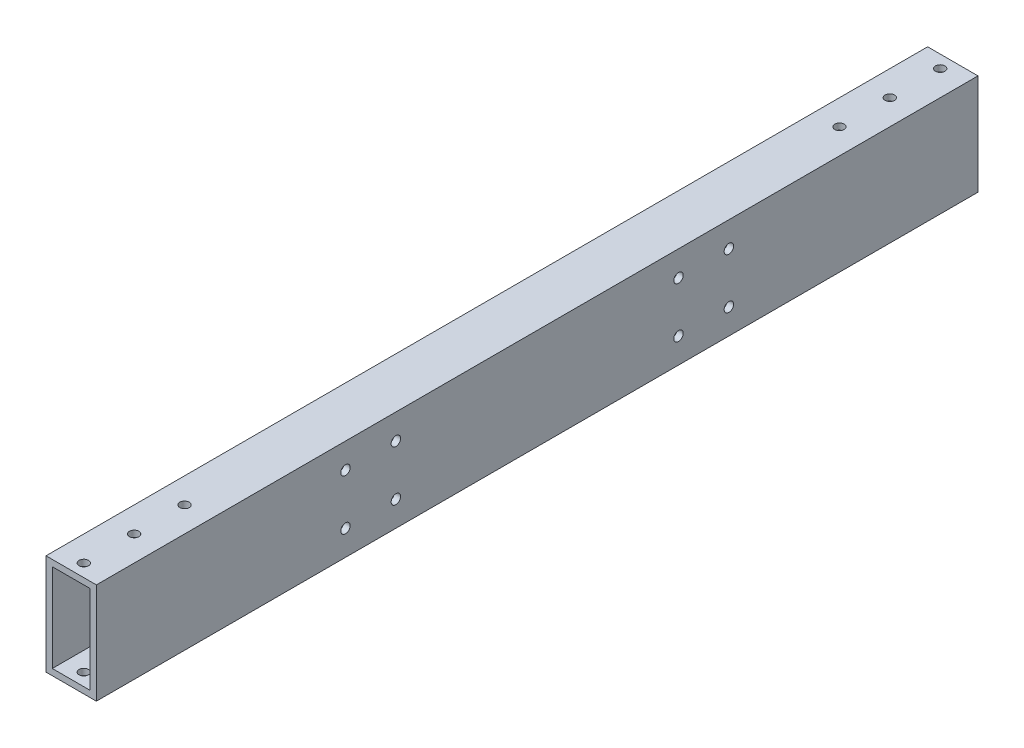
from build123d import *

# Parameters (mm, degrees)
SKETCH1_W           = 25.4
SKETCH1_H           = 50.8
BOSS_EXTRUDE1_DEPTH = 444.5
SHELL1_T            = -3.175
SKETCH2_R           = 2.38125
CUT_EXTRUDE1_DEPTH  = 448.573658742
SKETCH3_R           = 2.38125
CUT_EXTRUDE2_DEPTH  = 6.35


with BuildPart() as part:
    # Sketch1 → Boss-Extrude1 (new body)
    with BuildSketch(Plane.XY):
        Rectangle(SKETCH1_W, SKETCH1_H)
    extrude(amount=BOSS_EXTRUDE1_DEPTH)

    # Shell1
    shell1_openings = [part.faces().sort_by_distance(p)[0] for p in [
        (0, 0, 444.5),
        (0, 0, 0),
    ]]
    offset(amount=SHELL1_T, openings=shell1_openings, kind=Kind.INTERSECTION)

    # Sketch2 → Cut-Extrude1 (cut, through all)
    with BuildSketch(Plane(origin=(0, 25.4, 0), x_dir=(1, 0, 0), z_dir=(0, 1, 0))):
        with Locations(Location((0, -6.35, 0), (0, 0, 270))):
            Circle(SKETCH2_R)
        with Locations(Location((0, -31.75, 0), (0, 0, 270))):
            Circle(SKETCH2_R)
        with Locations(Location((0, -57.15, 0), (0, 0, 270))):
            Circle(SKETCH2_R)
        with Locations(Location((0, -387.35, 0), (0, 0, 270))):
            Circle(SKETCH2_R)
        with Locations(Location((0, -412.75, 0), (0, 0, 270))):
            Circle(SKETCH2_R)
        with Locations(Location((0, -438.15, 0), (0, 0, 270))):
            Circle(SKETCH2_R)
    extrude(amount=-CUT_EXTRUDE1_DEPTH, mode=Mode.SUBTRACT)

    # Sketch3 → Cut-Extrude2 (cut)
    with BuildSketch(Plane(origin=(12.7, 0, 0), x_dir=(0, 0, -1), z_dir=(1, 0, 0))):
        with Locations(Location((-125.603, -12.7, 0), (0, 0, 90))):
            Circle(SKETCH3_R)
        with Locations(Location((-125.603, 12.7, 0), (0, 0, 90))):
            Circle(SKETCH3_R)
        with Locations(Location((-151.003, 12.7, 0), (0, 0, 90))):
            Circle(SKETCH3_R)
        with Locations(Location((-151.003, -12.7, 0), (0, 0, 90))):
            Circle(SKETCH3_R)
        with Locations(Location((-293.497, -12.7, 0), (0, 0, 270))):
            Circle(SKETCH3_R)
        with Locations(Location((-293.497, 12.7, 0), (0, 0, 270))):
            Circle(SKETCH3_R)
        with Locations(Location((-318.897, 12.7, 0), (0, 0, 270))):
            Circle(SKETCH3_R)
        with Locations(Location((-318.897, -12.7, 0), (0, 0, 270))):
            Circle(SKETCH3_R)
    extrude(amount=-CUT_EXTRUDE2_DEPTH, mode=Mode.SUBTRACT)


solid = part.part
